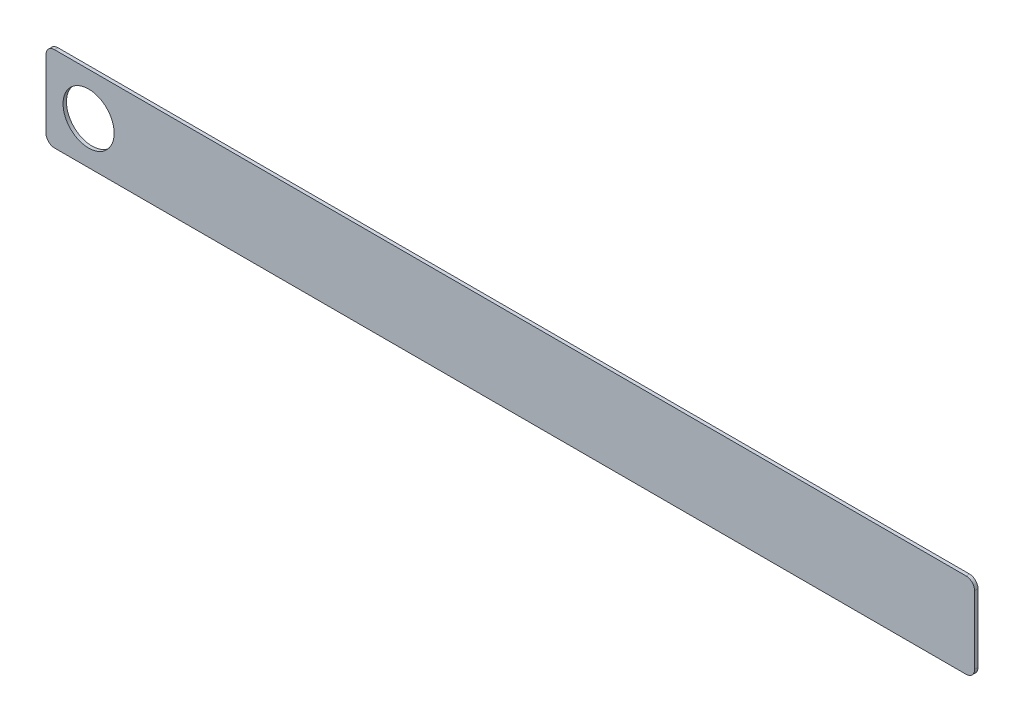
from build123d import *

# Parameters (mm, degrees)
SKETCH1_R           = 1.5
BOSS_EXTRUDE1_DEPTH = 0.2
SCALE6_SCALE        = 0.7


with BuildPart() as part:
    # Sketch1 → Boss-Extrude1 (new body)
    with BuildSketch(Plane.XY):
        with BuildLine():
            Line((-26.75, 2.5), (26.75, 2.5))
            ThreePointArc((26.75, 2.5), (27.103553391, 2.353553391), (27.25, 2))
            Line((27.25, 2), (27.25, -2))
            ThreePointArc((27.25, -2), (27.103553391, -2.353553391), (26.75, -2.5))
            Line((26.75, -2.5), (-26.75, -2.5))
            ThreePointArc((-26.75, -2.5), (-27.103553391, -2.353553391), (-27.25, -2))
            Line((-27.25, -2), (-27.25, 2))
            ThreePointArc((-27.25, 2), (-27.103553391, 2.353553391), (-26.75, 2.5))
        make_face()
        with Locations((-24.75, 0)):
            Circle(SKETCH1_R, mode=Mode.SUBTRACT)
    extrude(amount=BOSS_EXTRUDE1_DEPTH)


with BuildPart() as part_1:
    # Scale6: scaled about (0.659639326, 0, 0.1)
    add(part.part.scale(SCALE6_SCALE).moved(Location((0.197891798, 0, 0.03))))


solid = part_1.part
